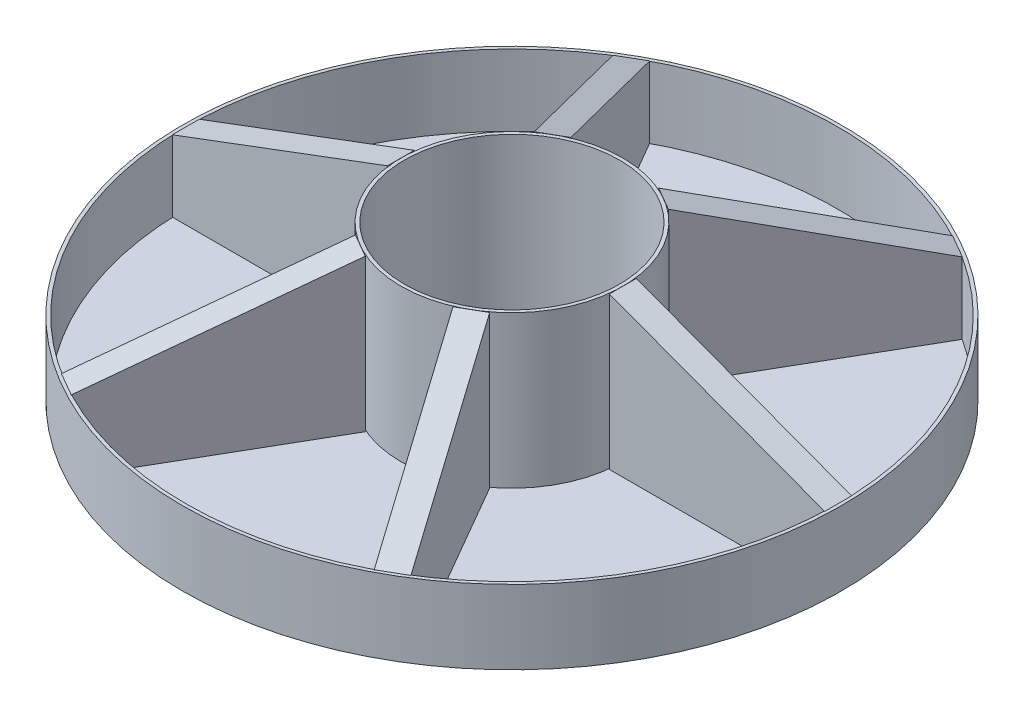
from build123d import *

# Parameters (mm, degrees)
SKETCH1_R           = 4.125
SKETCH1_R_2         = 4
BOSS_EXTRUDE1_DEPTH = 5.75
SKETCH1_4_R         = 12.25
SKETCH1_4_R_2       = 12.125
BOSS_EXTRUDE2_DEPTH = 2.75
SKETCH1_5_R         = 12.125
SKETCH1_5_R_2       = 4.125
BOSS_EXTRUDE3_DEPTH = 0.1
BOSS_EXTRUDE5_DEPTH = 0.5
CIRPATTERN4_COUNT   = 6


with BuildPart() as part:
    # Sketch1 → Boss-Extrude1 (new body)
    with BuildSketch(Plane(origin=(0, 0, 0), x_dir=(1, 0, 0), z_dir=(0, 1, 0))):
        with Locations(Location((0, 0, 0), (0, 0, 270))):
            Circle(SKETCH1_R)
        with Locations(Location((0, 0, 0), (0, 0, 270))):
            Circle(SKETCH1_R_2, mode=Mode.SUBTRACT)
    extrude(amount=BOSS_EXTRUDE1_DEPTH)



with BuildPart() as body_2:
    # Sketch1<4> → Boss-Extrude2 (new body)
    with BuildSketch(Plane(origin=(0, 0, 0), x_dir=(1, 0, 0), z_dir=(0, 1, 0))):
        with Locations(Location((0, 0, 0), (0, 0, 270))):
            Circle(SKETCH1_4_R)
        with Locations(Location((0, 0, 0), (0, 0, 270))):
            Circle(SKETCH1_4_R_2, mode=Mode.SUBTRACT)
    extrude(amount=BOSS_EXTRUDE2_DEPTH)


with BuildPart() as part_1:
    add(part.part)

    add(body_2.part)  # Boss-Extrude3 merges body 2
    # Sketch1<5> → Boss-Extrude3 (add)
    with BuildSketch(Plane(origin=(0, 0, 0), x_dir=(1, 0, 0), z_dir=(0, 1, 0))):
        with Locations(Location((0, 0, 0), (0, 0, 270))):
            Circle(SKETCH1_5_R)
        with Locations(Location((0, 0, 0), (0, 0, 270))):
            Circle(SKETCH1_5_R_2, mode=Mode.SUBTRACT)
    extrude(amount=BOSS_EXTRUDE3_DEPTH)


with BuildPart() as body_2_2:
    # Sketch7 → Boss-Extrude5 (new, symmetric)
    with BuildSketch(Plane.XY):
        Polygon((-4.125, 0.1), (-12.125, 0.1), (-12.125, 2.75), (-4.125, 5.75), align=None)
    extrude(amount=BOSS_EXTRUDE5_DEPTH, both=True)


with BuildPart() as cirpattern4_1:
    # CirPattern4: pattern copy
    add(body_2_2.part.rotate(Axis((0, 0, 0), (0, 1, 0)), 1 * 360 / CIRPATTERN4_COUNT))


with BuildPart() as cirpattern4_2:
    # CirPattern4: pattern copy
    add(body_2_2.part.rotate(Axis((0, 0, 0), (0, 1, 0)), 2 * 360 / CIRPATTERN4_COUNT))


with BuildPart() as cirpattern4_3:
    # CirPattern4: pattern copy
    add(body_2_2.part.rotate(Axis((0, 0, 0), (0, 1, 0)), 3 * 360 / CIRPATTERN4_COUNT))


with BuildPart() as cirpattern4_4:
    # CirPattern4: pattern copy
    add(body_2_2.part.rotate(Axis((0, 0, 0), (0, 1, 0)), 4 * 360 / CIRPATTERN4_COUNT))


with BuildPart() as cirpattern4_5:
    # CirPattern4: pattern copy
    add(body_2_2.part.rotate(Axis((0, 0, 0), (0, 1, 0)), 5 * 360 / CIRPATTERN4_COUNT))


solid = Compound([part_1.part, body_2_2.part, cirpattern4_1.part, cirpattern4_2.part, cirpattern4_3.part, cirpattern4_4.part, cirpattern4_5.part])
